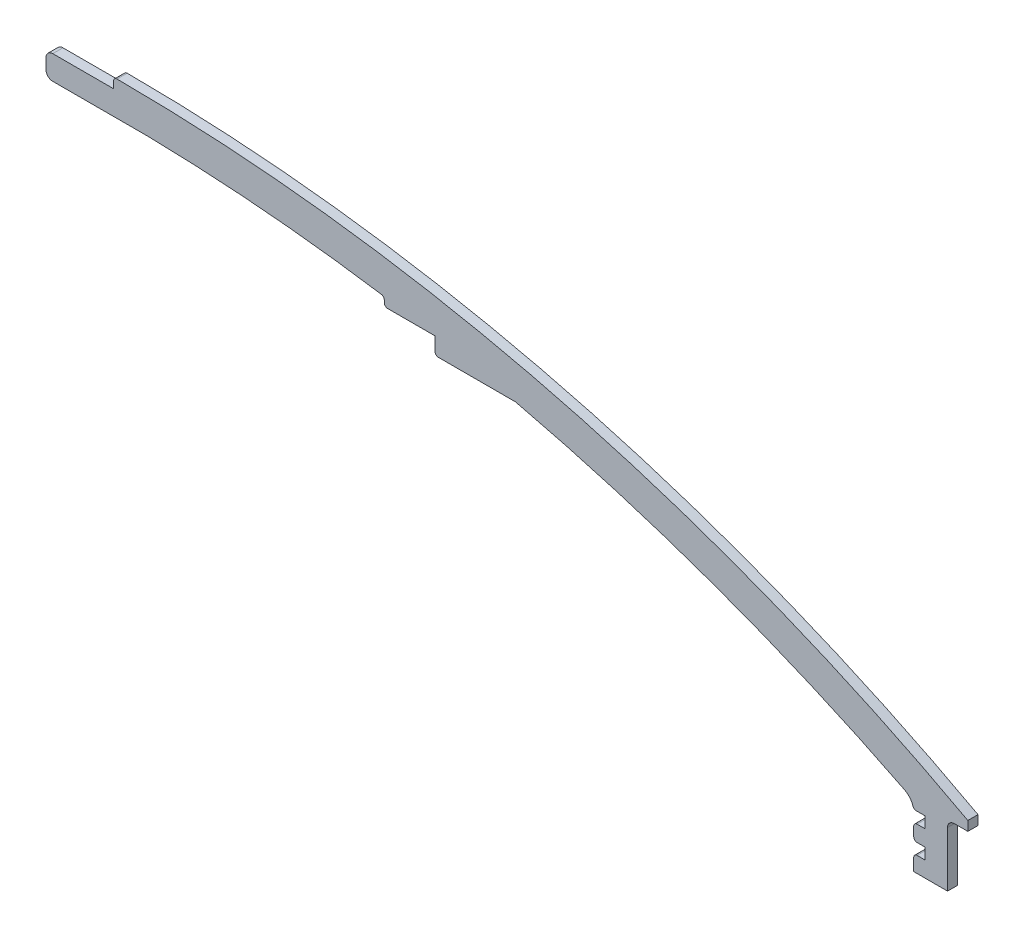
from build123d import *

# Parameters (mm, degrees)
BOSS_EXTRUDE1_DEPTH = 1.5
SKETCH3_W           = 4.820379215
SKETCH3_H           = 3.3
CUT_EXTRUDE1_DEPTH  = 10
FILLET1_R           = 1
SKETCH4_W           = 2
SKETCH4_H           = 7.019019915
CUT_EXTRUDE2_DEPTH  = 10


with BuildPart() as part:
    # Sketch2 → Boss-Extrude1 (new, symmetric)
    with BuildSketch(Plane.XY):
        with BuildLine():
            Line((299.5, -67.353443934), (293.5, -67.353443934))
            ThreePointArc((293.5, -67.353443934), (292.085786438, -67.939230372), (291.5, -69.353443934))
            Line((291.5, -69.353443934), (291.5, -85.649534053))
            Line((291.5, -85.649534053), (281.5, -85.649534053))
            Line((281.5, -85.649534053), (281.5, -70.504592149))
            ThreePointArc((281.5, -70.504592149), (280.757064897, -67.882112699), (278.749040614, -66.038966065))
            ThreePointArc((278.749040614, -66.038966065), (222.498981863, -41.753539728), (163.781589842, -24.257285386))
            Line((163.781589842, -24.257285386), (141, -24.257285386))
            ThreePointArc((141, -24.257285386), (140.292893219, -23.964392167), (140, -23.257285386))
            Line((140, -23.257285386), (140, -19.257285386))
            Line((140, -19.257285386), (126, -19.257285386))
            ThreePointArc((126, -19.257285386), (125.292893219, -18.964392167), (125, -18.257285386))
            Line((125, -18.257285386), (125, -17.551725847))
            ThreePointArc((125, -17.551725847), (124.759050209, -16.900693759), (124.152314439, -16.563393762))
            ThreePointArc((124.152314439, -16.563393762), (89.724531973, -12.428170907), (55.097618142, -10.598112953))
            ThreePointArc((55.097618142, -10.598112953), (55.000467449, -10.596696958), (54.903307584, -10.596224945))
            Line((54.903307584, -10.596224945), (27, -10.596224945))
            ThreePointArc((27, -10.596224945), (25.585786438, -10.010438507), (25, -8.596224945))
            Line((25, -8.596224945), (25, -5.5))
            ThreePointArc((25, -5.5), (25.585786438, -4.085786438), (27, -3.5))
            Line((27, -3.5), (45, -3.5))
            Line((45, -3.5), (45, -1.500945781))
            ThreePointArc((45, -1.500945781), (45.293562303, -0.793170548), (46.001891561, -0.50094757))
            ThreePointArc((46.001891561, -0.50094757), (176.838494864, -17.170276226), (299.5, -65.649534053))
            Line((299.5, -65.649534053), (299.5, -67.353443934))
        make_face()
    extrude(amount=BOSS_EXTRUDE1_DEPTH, both=True)

    # Sketch3 → Cut-Extrude1 (cut)
    with BuildSketch(Plane.XY.offset(1.5)):
        with Locations((282.389810393, -71.353443934)):
            Rectangle(SKETCH3_W, SKETCH3_H)
        with Locations((282.389810393, -79.353443934)):
            Rectangle(SKETCH3_W, SKETCH3_H)
    extrude(amount=-CUT_EXTRUDE1_DEPTH, mode=Mode.SUBTRACT)

    # Fillet1
    fillet1_edges = [part.edges().sort_by_distance(p)[0] for p in [
        (281.435398823, -69.703443934, 0),
        (281.5, -73.003443934, 0),
        (281.5, -81.003443934, 0),
        (281.5, -77.703443934, 0),
    ]]
    fillet(fillet1_edges, radius=FILLET1_R)

    # Sketch4 → Cut-Extrude2 (cut)
    with BuildSketch(Plane.XY.offset(1.5)):
        with Locations((298.5, -66.105228371)):
            Rectangle(SKETCH4_W, SKETCH4_H)
    extrude(amount=-CUT_EXTRUDE2_DEPTH, mode=Mode.SUBTRACT)


solid = part.part
